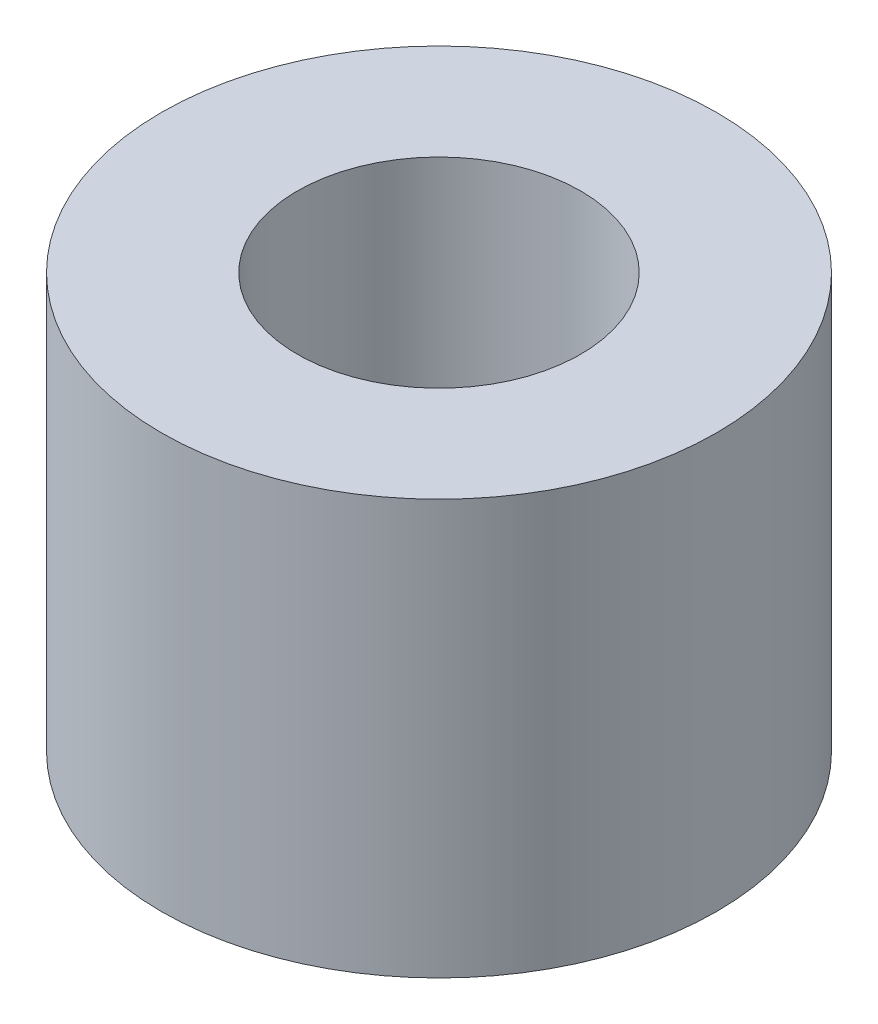
from build123d import *

# Parameters (mm, degrees)
SKETCH1_R           = 6.223
SKETCH1_R_2         = 3.175
BOSS_EXTRUDE1_DEPTH = 9.2964


with BuildPart() as part:
    # Sketch1 → Boss-Extrude1 (new body)
    with BuildSketch(Plane(origin=(0, 0, 0), x_dir=(1, 0, 0), z_dir=(0, 1, 0))):
        with Locations(Location((0, 0, 0), (0, 0, 90))):
            Circle(SKETCH1_R)
        with Locations(Location((0, 0, 0), (0, 0, 90))):
            Circle(SKETCH1_R_2, mode=Mode.SUBTRACT)
    extrude(amount=BOSS_EXTRUDE1_DEPTH)


solid = part.part
